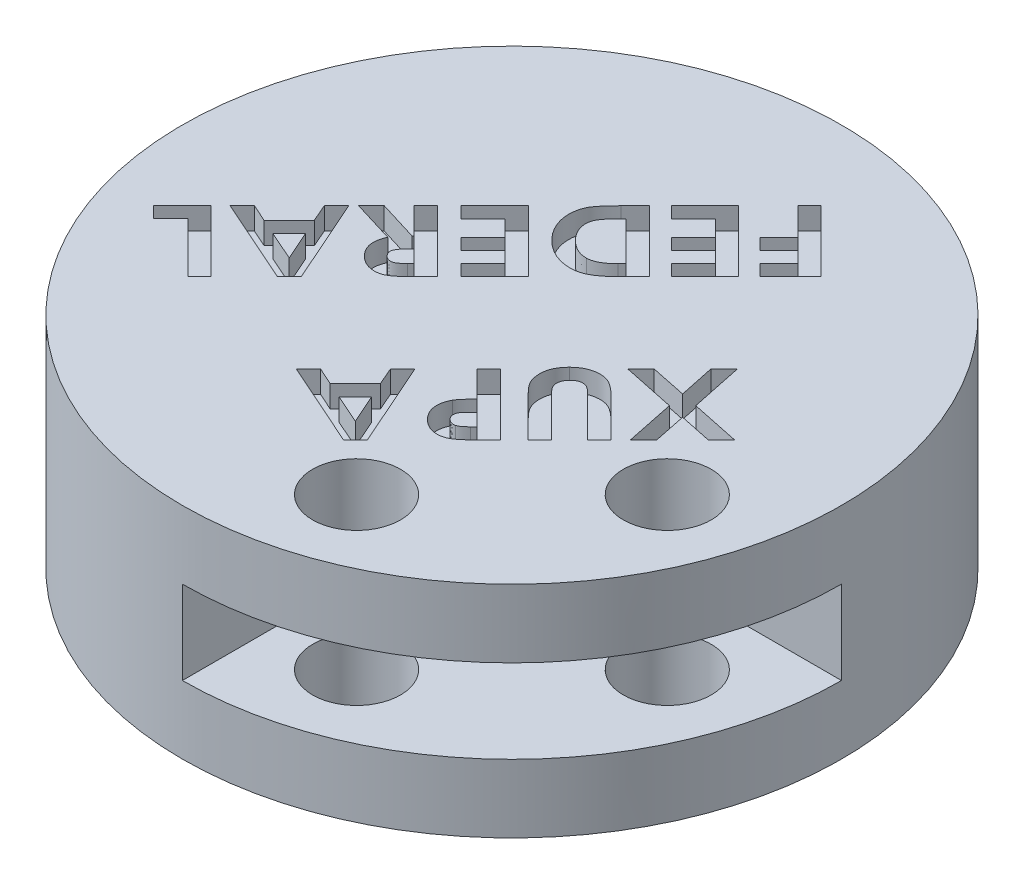
from build123d import *

# Parameters (mm, degrees)
ESBO_O1_R                = 15
RESSALTO_EXTRUS_O1_DEPTH = 10
CORTE_EXTRUS_O1_DEPTH    = 1.9
CORTE_EXTRUS_O2_DEPTH    = 1
ESBO_O4_R                = 2
CORTE_EXTRUS_O3_DEPTH    = 10


with BuildPart() as part:
    # Esboço1 → Ressalto-extrusão1 (new body)
    with BuildSketch(Plane(origin=(0, 0, 0), x_dir=(1, 0, 0), z_dir=(0, 1, 0))):
        with Locations(Location((0, 0, 0), (0, 0, 270))):
            Circle(ESBO_O1_R)
    extrude(amount=RESSALTO_EXTRUS_O1_DEPTH)

    # Esboço2 → Corte-extrusão1 (cut, symmetric)
    with BuildSketch(Plane(origin=(0, 5, 0), x_dir=(1, 0, 0), z_dir=(0, 1, 0))):
        with BuildLine():
            Line((0, 0), (0, -15))
            ThreePointArc((0, -15), (10.606601718, -10.606601718), (15, 0))
            Line((15, 0), (0, 0))
        make_face()
    extrude(amount=CORTE_EXTRUS_O1_DEPTH, both=True, mode=Mode.SUBTRACT)

    # Esboço3 → Corte-extrusão2 (cut)
    # profile 1 of 11: a face of its own
    with BuildSketch(Plane(origin=(0, 10, 0), x_dir=(1, 0, 0), z_dir=(0, 1, 0))):
        Polygon((9.991286616, 0.149286954), (9.391927642, -0.45007202), (7.908754565, -0.139975866), (8.214043026, -1.627956635), (7.614684052, -2.22731561), (7.149940462, 0.017876698), (4.759716103, 0.517075416), (5.359075077, 1.11643439), (6.989684052, 0.779094647), (6.647536616, 2.404895929), (7.250902001, 3.008261313), (7.749299436, 0.617235672), align=None)
    # profile 2 of 11: a face of its own
    with BuildSketch(Plane(origin=(0, 10, 0), x_dir=(1, 0, 0), z_dir=(0, 1, 0))):
        with BuildLine():
            Line((7.180707384, -2.661292278), (6.645450974, -3.196548688))
            Line((6.645450974, -3.196548688), (4.833752256, -1.38484997))
            add(Edge.make_bspline(
                [(4.833752256, -1.38484997), (4.814980423, -1.365951564), (4.778883239, -1.329610987), (4.723852413, -1.280516693), (4.673587811, -1.235055859), (4.625832514, -1.195485687), (4.579817509, -1.163212689), (4.538266899, -1.134352064), (4.499080496, -1.111944161), (4.451298509, -1.089463258), (4.392195918, -1.070709164), (4.319776621, -1.058896446), (4.245405818, -1.060313445), (4.169952547, -1.07207795), (4.094923033, -1.096640536), (4.021417669, -1.13275446), (3.951263817, -1.18272074), (3.90811027, -1.222493458), (3.885835589, -1.243023047)],
                knots=[0, 0, 0, 0, 1.155988666, 2.22290156, 3.200185092, 4.098338149, 4.912408615, 5.639149433, 6.293474047, 6.869225543, 7.928869047, 8.973436072, 10.04015996, 11.143797855, 12.276765443, 13.453784809, 14.68571333, 16, 16, 16, 16], degree=3))
            add(Edge.make_bspline(
                [(3.885835589, -1.243023047), (3.863718248, -1.266452023), (3.820816448, -1.311898048), (3.770289331, -1.38866979), (3.730692615, -1.467401447), (3.706176365, -1.549388313), (3.694162567, -1.630659957), (3.693759699, -1.709589405), (3.70597644, -1.785076419), (3.726206606, -1.846155909), (3.751101425, -1.895430543), (3.776856555, -1.936953032), (3.810285942, -1.982379993), (3.849268564, -2.033086641), (3.896271024, -2.087230999), (3.949147711, -2.146785069), (4.009102225, -2.210806412), (4.052373216, -2.254100113), (4.074938153, -2.276676893)],
                knots=[0, 0, 0, 0, 1.269430647, 2.462360122, 3.612748249, 4.736601737, 5.82345567, 6.8460343, 7.839115339, 8.829226346, 9.371399259, 10.015068757, 10.755267661, 11.596652523, 12.538854489, 13.584166433, 14.740192216, 16, 16, 16, 16], degree=3))
            Line((4.074938153, -2.276676893), (5.820130461, -4.021869201))
            Line((5.820130461, -4.021869201), (5.28487405, -4.557125611))
            Line((5.28487405, -4.557125611), (3.615803538, -2.888055098))
            add(Edge.make_bspline(
                [(3.615803538, -2.888055098), (3.582053694, -2.853960352), (3.517338181, -2.788583486), (3.425818641, -2.693111315), (3.343770788, -2.604634719), (3.272585299, -2.521261891), (3.208842026, -2.446098373), (3.156164459, -2.376187717), (3.112208564, -2.313763509), (3.066898784, -2.23837864), (3.022384135, -2.143530903), (2.98343645, -2.0227707), (2.9550962, -1.893215931), (2.940593664, -1.756244121), (2.938425442, -1.616907874), (2.951959837, -1.479746014), (2.981154044, -1.347571728), (3.024671312, -1.219376631), (3.084818578, -1.095075922), (3.161181387, -0.973650658), (3.252495722, -0.853329337), (3.324134572, -0.778910762), (3.360995845, -0.740619201)],
                knots=[0, 0, 0, 0, 1.156671007, 2.217923112, 3.188722769, 4.065350849, 4.861034249, 5.564279587, 6.175220097, 6.700928795, 7.683279425, 8.693375947, 9.754413098, 10.875210989, 12.008702769, 13.10894238, 14.190228459, 15.265514612, 16.365810762, 17.511258597, 18.719435398, 20, 20, 20, 20], degree=3))
            add(Edge.make_bspline(
                [(3.360995845, -0.740619201), (3.386300292, -0.715946953), (3.436196282, -0.667297549), (3.515733708, -0.601724864), (3.597252525, -0.543258255), (3.679177841, -0.489780506), (3.764206752, -0.444927982), (3.850530585, -0.406235762), (3.939307655, -0.374916631), (4.029347985, -0.350315193), (4.119572131, -0.331947416), (4.208443518, -0.31976766), (4.295467345, -0.314323142), (4.380615597, -0.313973418), (4.464196891, -0.3204774), (4.545978902, -0.333089432), (4.625621203, -0.352826987), (4.705422235, -0.377654043), (4.78700273, -0.413128641), (4.872909824, -0.460395543), (4.964971524, -0.519012865), (5.062714695, -0.590190558), (5.167130555, -0.672873699), (5.276950527, -0.768399261), (5.393780657, -0.874930422), (5.471335911, -0.952113963), (5.511636871, -0.992221765)],
                knots=[0, 0, 0, 0, 1.021916422, 2.015042341, 2.977805161, 3.922892496, 4.842241783, 5.755304681, 6.656954872, 7.562205534, 8.453100996, 9.318439889, 10.154558045, 10.973474217, 11.77931275, 12.576962411, 13.363952912, 14.150677929, 14.991636173, 15.931911616, 16.984242602, 18.146377834, 19.427737307, 20.835519037, 22.355603098, 24, 24, 24, 24], degree=3))
            Line((5.511636871, -0.992221765), (7.180707384, -2.661292278))
        make_face()
    # profile 3 of 11: a face of its own
    with BuildSketch(Plane(origin=(0, 10, 0), x_dir=(1, 0, 0), z_dir=(0, 1, 0))):
        with BuildLine():
            Line((4.66100903, -5.180990632), (4.096105184, -5.745894478))
            add(Edge.make_bspline(
                [(4.096105184, -5.745894478), (4.058899857, -5.782415165), (3.987162549, -5.852832388), (3.880516245, -5.951389838), (3.779570243, -6.039957989), (3.683797787, -6.117737072), (3.593060216, -6.184467826), (3.508013876, -6.241064867), (3.428247607, -6.287204446), (3.329197095, -6.332873766), (3.207098245, -6.372940176), (3.058017376, -6.396654712), (2.906578837, -6.395390919), (2.78036702, -6.375146777), (2.679743636, -6.347952776), (2.605186391, -6.320352266), (2.531684934, -6.287413957), (2.459813265, -6.248012179), (2.388782625, -6.202903995), (2.319406772, -6.15151218), (2.250745488, -6.094696823), (2.207725016, -6.052571792), (2.185848773, -6.031150888)],
                knots=[0, 0, 0, 0, 1.406641271, 2.712209948, 3.917624628, 5.029648842, 6.04009536, 6.955560074, 7.785096033, 8.523504981, 9.895491185, 11.237914943, 12.57840281, 13.964662288, 14.674488314, 15.388109057, 16.107420444, 16.845934891, 17.597658369, 18.376028278, 19.174197811, 20, 20, 20, 20], degree=3))
            add(Edge.make_bspline(
                [(2.185848773, -6.031150888), (2.162217551, -6.006664106), (2.116155653, -5.958934553), (2.054842338, -5.882603463), (2.000906484, -5.805148008), (1.955279826, -5.725315212), (1.91612517, -5.644561259), (1.886798154, -5.561308051), (1.863967142, -5.477024351), (1.849478777, -5.391134343), (1.843653057, -5.304505593), (1.842948248, -5.217656675), (1.851610967, -5.131170704), (1.865803242, -5.044839417), (1.887683955, -4.958859256), (1.916558787, -4.873135626), (1.952709914, -4.787658), (1.981909226, -4.732337631), (1.996746209, -4.704227811)],
                knots=[0, 0, 0, 0, 1.126101865, 2.194993951, 3.23744383, 4.247590149, 5.236418428, 6.204186264, 7.165102631, 8.124553194, 9.082168344, 10.037167055, 10.996250816, 11.955701378, 12.931515311, 13.929787448, 14.948067339, 16, 16, 16, 16], degree=3))
            add(Edge.make_bspline(
                [(1.996746209, -4.704227811), (2.00715326, -4.686420805), (2.029646495, -4.647933709), (2.072462865, -4.5895141), (2.123799586, -4.524038906), (2.18356915, -4.451325673), (2.252895899, -4.372604602), (2.331773478, -4.287693575), (2.419640827, -4.195785443), (2.481957248, -4.132817325), (2.514374414, -4.100061144)],
                knots=[0, 0, 0, 0, 0.620398817, 1.340896353, 2.177090738, 3.125061034, 4.173198094, 5.333690957, 6.612979008, 8, 8, 8, 8], degree=3))
            Line((2.514374414, -4.100061144), (1.328476979, -2.914163709))
            Line((1.328476979, -2.914163709), (1.861329543, -2.381311144))
            Line((1.861329543, -2.381311144), (4.66100903, -5.180990632))
        make_face()
        with BuildLine():
            Line((3.033605184, -4.619291914), (2.864534671, -4.788362426))
            add(Edge.make_bspline(
                [(2.864534671, -4.788362426), (2.833968437, -4.819249334), (2.777822167, -4.875984639), (2.706331587, -4.958635987), (2.652342591, -5.028904288), (2.615009506, -5.090153714), (2.594559971, -5.147108986), (2.581418874, -5.201408668), (2.579789494, -5.256704534), (2.584815693, -5.312227712), (2.600417936, -5.366879169), (2.624841393, -5.419493209), (2.658183245, -5.470176911), (2.686427331, -5.500304203), (2.701073132, -5.515926529)],
                knots=[0, 0, 0, 0, 1.826704509, 3.35542295, 4.590751503, 5.551906901, 6.355007882, 7.126061508, 7.890461977, 8.669327237, 9.462234463, 10.266198699, 11.100947754, 12, 12, 12, 12], degree=3))
            add(Edge.make_bspline(
                [(2.701073132, -5.515926529), (2.714422462, -5.528526519), (2.740447557, -5.553090743), (2.782915233, -5.583686249), (2.826854491, -5.606908432), (2.871117414, -5.625299732), (2.91744213, -5.63587945), (2.96492254, -5.638421867), (3.013801283, -5.636760433), (3.045967038, -5.629449087), (3.062451338, -5.62570217)],
                knots=[0, 0, 0, 0, 1.109423344, 2.162868797, 3.152982245, 4.10985909, 5.05424694, 6.009486231, 6.979901905, 8, 8, 8, 8], degree=3))
            add(Edge.make_bspline(
                [(3.062451338, -5.62570217), (3.075415411, -5.622078795), (3.102909821, -5.614394285), (3.143922606, -5.593768507), (3.188729943, -5.568336405), (3.236627386, -5.536148558), (3.287459517, -5.497352779), (3.340833261, -5.451175205), (3.398559388, -5.399653154), (3.436823303, -5.361730181), (3.456682107, -5.342048324)],
                knots=[0, 0, 0, 0, 0.657275167, 1.393959472, 2.23694375, 3.179428826, 4.214595909, 5.3643029, 6.632084791, 8, 8, 8, 8], degree=3))
            Line((3.456682107, -5.342048324), (3.60652185, -5.19220858))
            Line((3.60652185, -5.19220858), (3.033605184, -4.619291914))
        make_face(mode=Mode.SUBTRACT)
    # profile 4 of 11: a face of its own
    with BuildSketch(Plane(origin=(0, 10, 0), x_dir=(1, 0, 0), z_dir=(0, 1, 0))):
        Polygon((1.63112919, -8.210870471), (1.090263806, -8.751735856), (-2.786338758, -7.028979446), (-2.232652861, -6.475293548), (-1.436979784, -6.833466625), (-0.295152861, -5.691639702), (-0.643710553, -4.88635124), (-0.089223374, -4.331864061), align=None)
        Polygon((0.614302267, -7.742120471), (0.026161242, -6.408787138), (-0.717428502, -7.152376881), align=None, mode=Mode.SUBTRACT)
    # profile 5 of 11: a face of its own
    with BuildSketch(Plane(origin=(0, 10, 0), x_dir=(1, 0, 0), z_dir=(0, 1, 0))):
        Polygon((5.521678914, 8.552648859), (4.13305712, 7.164027064), (3.613025068, 7.684059116), (4.475204555, 8.546238603), (3.967191735, 9.054251423), (3.105012248, 8.192071936), (2.592993017, 8.704091167), (3.455172504, 9.566270654), (2.19555712, 10.825886039), (2.721999427, 11.352328346), align=None)
    # profile 6 of 11: a face of its own
    with BuildSketch(Plane(origin=(0, 10, 0), x_dir=(1, 0, 0), z_dir=(0, 1, 0))):
        Polygon((3.642471088, 6.673441032), (2.113624934, 5.144594879), (1.591990318, 5.666229494), (2.591189036, 6.665428212), (2.08477878, 7.171838468), (1.085580062, 6.17263975), (0.573560831, 6.684658981), (1.572759549, 7.683857699), (0.836381344, 8.420235904), (-0.162817374, 7.421037186), (-0.686054553, 7.944274366), (0.8427916, 9.47312052), align=None)
    # profile 7 of 11: a face of its own
    with BuildSketch(Plane(origin=(0, 10, 0), x_dir=(1, 0, 0), z_dir=(0, 1, 0))):
        with BuildLine():
            Line((1.61180546, 4.642775404), (0.979593921, 4.010563866))
            add(Edge.make_bspline(
                [(0.979593921, 4.010563866), (0.929955243, 3.961899915), (0.833730032, 3.867564227), (0.689122426, 3.735963705), (0.548694859, 3.619825101), (0.414063887, 3.516981218), (0.283616507, 3.430162249), (0.159260135, 3.355672145), (0.038730318, 3.298193664), (-0.077388171, 3.252858053), (-0.192599672, 3.220439478), (-0.30893124, 3.197938641), (-0.427953285, 3.18535857), (-0.549534834, 3.181346351), (-0.673762244, 3.186339777), (-0.800715014, 3.199871418), (-0.930250679, 3.223449694), (-1.06158577, 3.256317318), (-1.1933281, 3.297377435), (-1.323248245, 3.349058165), (-1.450288773, 3.411125063), (-1.575679961, 3.481371046), (-1.697810564, 3.562363154), (-1.818004801, 3.651823456), (-1.935465773, 3.751721534), (-2.010371453, 3.82398688), (-2.048450951, 3.860724122)],
                knots=[0, 0, 0, 0, 1.439034866, 2.789587404, 4.046242051, 5.210749521, 6.294998322, 7.288851825, 8.208867441, 9.056044777, 9.866460813, 10.683040655, 11.506165398, 12.341567733, 13.199272088, 14.077965293, 14.98253088, 15.92263245, 16.879224752, 17.837222352, 18.814071862, 19.804442961, 20.810496319, 21.845608965, 22.904780916, 24, 24, 24, 24], degree=3))
            add(Edge.make_bspline(
                [(-2.048450951, 3.860724122), (-2.099953016, 3.914847336), (-2.201382212, 4.021438673), (-2.333664719, 4.194340895), (-2.445882211, 4.374211473), (-2.538081491, 4.559263389), (-2.608335019, 4.747748126), (-2.659103552, 4.935677989), (-2.686556813, 5.123136184), (-2.692167943, 5.307847716), (-2.677337095, 5.486581821), (-2.646890883, 5.657253738), (-2.596599994, 5.817699827), (-2.539753685, 5.945782252), (-2.480563989, 6.04791725), (-2.423013217, 6.131441473), (-2.354550386, 6.224073629), (-2.274092279, 6.324778171), (-2.179228875, 6.431600904), (-2.074618778, 6.548359536), (-1.956611702, 6.672167057), (-1.873106567, 6.756692171), (-1.829700951, 6.800627968)],
                knots=[0, 0, 0, 0, 1.317839513, 2.595379447, 3.834063156, 5.05466701, 6.237550534, 7.378660222, 8.483962212, 9.57336849, 10.63268142, 11.644157635, 12.626693665, 13.593039203, 14.110493631, 14.707986141, 15.382087559, 16.143302665, 16.981856857, 17.903007519, 18.909992176, 20, 20, 20, 20], degree=3))
            Line((-1.829700951, 6.800627968), (-1.187874028, 7.442454892))
            Line((-1.187874028, 7.442454892), (1.61180546, 4.642775404))
        make_face()
        with BuildLine():
            Line((0.566132383, 4.625948481), (-1.197489412, 6.389570276))
            Line((-1.197489412, 6.389570276), (-1.445085566, 6.141974122))
            add(Edge.make_bspline(
                [(-1.445085566, 6.141974122), (-1.474072863, 6.112195469), (-1.5300926, 6.054646385), (-1.608685633, 5.969364403), (-1.677992826, 5.887339926), (-1.738365151, 5.808862459), (-1.789700144, 5.733658248), (-1.832466631, 5.662321859), (-1.866757924, 5.59476385), (-1.900020318, 5.509252307), (-1.924839801, 5.399946591), (-1.93298642, 5.263734065), (-1.916844295, 5.121156201), (-1.882342812, 4.972934383), (-1.821924328, 4.822593905), (-1.737822598, 4.672801422), (-1.628275365, 4.525190933), (-1.541453534, 4.433288237), (-1.496367617, 4.385563866)],
                knots=[0, 0, 0, 0, 0.979925141, 1.893765722, 2.734044598, 3.511273851, 4.227493601, 4.879892629, 5.47138308, 6.011741413, 7.039904603, 8.099867681, 9.214125303, 10.411785622, 11.678404231, 13.020547134, 14.452792779, 16, 16, 16, 16], degree=3))
            add(Edge.make_bspline(
                [(-1.496367617, 4.385563866), (-1.459507618, 4.350249264), (-1.387635004, 4.281389991), (-1.273581075, 4.190528159), (-1.157805479, 4.114202405), (-1.041103248, 4.050569791), (-0.922222936, 4.002358915), (-0.801565165, 3.968429674), (-0.679520514, 3.94762683), (-0.597408463, 3.945245094), (-0.556463771, 3.944057456)],
                knots=[0, 0, 0, 0, 1.147925532, 2.238318219, 3.274870098, 4.264161038, 5.223719486, 6.153875931, 7.079441097, 8, 8, 8, 8], degree=3))
            add(Edge.make_bspline(
                [(-0.556463771, 3.944057456), (-0.518948996, 3.945973197), (-0.442663105, 3.949868837), (-0.328303065, 3.975221391), (-0.212427678, 4.014922991), (-0.095655832, 4.071140957), (0.023685143, 4.141138996), (0.143928153, 4.227695651), (0.265608741, 4.329664355), (0.344369404, 4.40562927), (0.385042639, 4.444858738)],
                knots=[0, 0, 0, 0, 0.823804914, 1.675198423, 2.561952133, 3.509254724, 4.516353536, 5.597223391, 6.759168657, 8, 8, 8, 8], degree=3))
            Line((0.385042639, 4.444858738), (0.566132383, 4.625948481))
        make_face(mode=Mode.SUBTRACT)
    # profile 8 of 11: a face of its own
    with BuildSketch(Plane(origin=(0, 10, 0), x_dir=(1, 0, 0), z_dir=(0, 1, 0))):
        Polygon((-1.144097893, 1.886872052), (-2.672944047, 0.358025898), (-3.194578662, 0.879660514), (-2.195379944, 1.878859232), (-2.7017902, 2.385269488), (-3.700988918, 1.38607077), (-4.213008149, 1.898090001), (-3.213809431, 2.897288719), (-3.950187636, 3.633666924), (-4.949386354, 2.634468206), (-5.472623534, 3.157705385), (-3.94377738, 4.686551539), align=None)
    # profile 9 of 11: a face of its own
    with BuildSketch(Plane(origin=(0, 10, 0), x_dir=(1, 0, 0), z_dir=(0, 1, 0))):
        with BuildLine():
            Line((-3.209218649, -0.178248704), (-3.774923777, -0.743953832))
            add(Edge.make_bspline(
                [(-3.774923777, -0.743953832), (-3.812356447, -0.781049851), (-3.884428262, -0.852473487), (-3.992157002, -0.951804591), (-4.093517901, -1.041050155), (-4.189583868, -1.118712869), (-4.279663073, -1.185960447), (-4.364117423, -1.242032915), (-4.442996539, -1.287449707), (-4.539268657, -1.333622616), (-4.659996696, -1.370609466), (-4.807683988, -1.394256385), (-4.959631962, -1.391504627), (-5.087192912, -1.371702422), (-5.189084702, -1.344251517), (-5.264816858, -1.316974717), (-5.339171735, -1.284068903), (-5.411365111, -1.244268715), (-5.482648168, -1.1994902), (-5.552644368, -1.149118559), (-5.620042261, -1.091645204), (-5.663216038, -1.050262968), (-5.685180187, -1.029210243)],
                knots=[0, 0, 0, 0, 1.421978541, 2.737837732, 3.953519399, 5.065633402, 6.070361753, 6.985900385, 7.799411416, 8.524821276, 9.862857507, 11.190037478, 12.545105683, 13.945717307, 14.662554921, 15.389788545, 16.115735282, 16.85430936, 17.612184021, 18.386367678, 19.179083583, 20, 20, 20, 20], degree=3))
            add(Edge.make_bspline(
                [(-5.685180187, -1.029210243), (-5.707457564, -1.00630748), (-5.7511841, -0.96135342), (-5.809201414, -0.889437901), (-5.862247447, -0.817806799), (-5.905656535, -0.743196216), (-5.94520826, -0.669088564), (-5.975254788, -0.592205073), (-5.999610573, -0.514654328), (-6.016533682, -0.435530308), (-6.026225965, -0.355066852), (-6.028308697, -0.273301396), (-6.024446169, -0.189951158), (-6.013096344, -0.105276941), (-5.994666359, -0.019247609), (-5.968228717, 0.067704593), (-5.936872663, 0.156678357), (-5.91026071, 0.215099416), (-5.896718649, 0.244828219)],
                knots=[0, 0, 0, 0, 1.101414134, 2.161880473, 3.184660909, 4.172144899, 5.136319069, 6.0789497, 7.014349383, 7.937694207, 8.865577957, 9.805684083, 10.755713988, 11.740745346, 12.749025231, 13.786758006, 14.873744543, 16, 16, 16, 16], degree=3))
            Line((-5.896718649, 0.244828219), (-7.803769931, 0.826558988))
            Line((-7.803769931, 0.826558988), (-7.22123788, 1.409091039))
            Line((-7.22123788, 1.409091039), (-5.405532751, 0.853001296))
            Line((-5.405532751, 0.853001296), (-5.355853264, 0.902680783))
            Line((-5.355853264, 0.902680783), (-6.5417507, 2.088578219))
            Line((-6.5417507, 2.088578219), (-6.008898136, 2.621430783))
            Line((-6.008898136, 2.621430783), (-3.209218649, -0.178248704))
        make_face()
        with BuildLine():
            Line((-4.836622495, 0.383450014), (-5.004090444, 0.215982065))
            add(Edge.make_bspline(
                [(-5.004090444, 0.215982065), (-5.024303969, 0.195318491), (-5.063040143, 0.155719867), (-5.115882047, 0.096071422), (-5.162821256, 0.04022553), (-5.202363187, -0.013465379), (-5.234178271, -0.064527945), (-5.259911201, -0.112132336), (-5.277642827, -0.157408821), (-5.292989023, -0.21316122), (-5.295818491, -0.283240194), (-5.273827657, -0.365508774), (-5.230236331, -0.446746638), (-5.18666919, -0.493812816), (-5.163545572, -0.518793576)],
                knots=[0, 0, 0, 0, 1.201335271, 2.302177953, 3.311429629, 4.232969088, 5.070863541, 5.810798595, 6.478771136, 7.08736359, 8.209552627, 9.343161366, 10.589861104, 12, 12, 12, 12], degree=3))
            add(Edge.make_bspline(
                [(-5.163545572, -0.518793576), (-5.148122996, -0.532818617), (-5.118001012, -0.560211061), (-5.067958082, -0.593769247), (-5.014157175, -0.617242502), (-4.958110589, -0.63156432), (-4.900829785, -0.637234529), (-4.843737272, -0.634155032), (-4.787398724, -0.621547692), (-4.740778122, -0.604429306), (-4.702585112, -0.583755414), (-4.669750961, -0.564104211), (-4.634702035, -0.537898981), (-4.596196375, -0.50716611), (-4.55355843, -0.472410563), (-4.50904332, -0.430779751), (-4.460074137, -0.385760447), (-4.427316494, -0.353051884), (-4.410340444, -0.336101268)],
                knots=[0, 0, 0, 0, 1.128447796, 2.203982445, 3.247103288, 4.292930286, 5.325256976, 6.354231782, 7.375957681, 8.442892605, 9.031898334, 9.726743301, 10.513977804, 11.399823452, 12.396550797, 13.492525903, 14.700547375, 16, 16, 16, 16], degree=3))
            Line((-4.410340444, -0.336101268), (-4.263705828, -0.189466653))
            Line((-4.263705828, -0.189466653), (-4.836622495, 0.383450014))
        make_face(mode=Mode.SUBTRACT)
    # profile 10 of 11: a face of its own
    with BuildSketch(Plane(origin=(0, 10, 0), x_dir=(1, 0, 0), z_dir=(0, 1, 0))):
        Polygon((-6.310223891, -3.279253946), (-6.851089275, -3.820119331), (-10.727691839, -2.09736292), (-10.174005942, -1.543677023), (-9.378332865, -1.9018501), (-8.236505942, -0.760023177), (-8.585063634, 0.045265285), (-8.030576455, 0.599752464), align=None)
        Polygon((-7.327050814, -2.810503946), (-7.915191839, -1.477170613), (-8.658781583, -2.220760356), align=None, mode=Mode.SUBTRACT)
    # profile 11 of 11: a face of its own
    with BuildSketch(Plane(origin=(0, 10, 0), x_dir=(1, 0, 0), z_dir=(0, 1, 0))):
        Polygon((-8.358610685, -5.327640741), (-8.891463249, -5.860493305), (-11.183129916, -3.568826638), (-11.959572224, -4.345268946), (-12.467585044, -3.837256125), (-11.158290172, -2.527961253), align=None)
    extrude(amount=-CORTE_EXTRUS_O2_DEPTH, mode=Mode.SUBTRACT)

    # Esboço4 → Corte-extrusão3 (cut)
    with BuildSketch(Plane(origin=(0, 10, 0), x_dir=(1, 0, 0), z_dir=(0, 1, 0))):
        with Locations(Location((10.606601718, -3.535533906, 0), (0, 0, 270))):
            Circle(ESBO_O4_R)
        with Locations(Location((3.535533906, -10.606601718, 0), (0, 0, 270))):
            Circle(ESBO_O4_R)
    extrude(amount=-CORTE_EXTRUS_O3_DEPTH, mode=Mode.SUBTRACT)


solid = part.part
